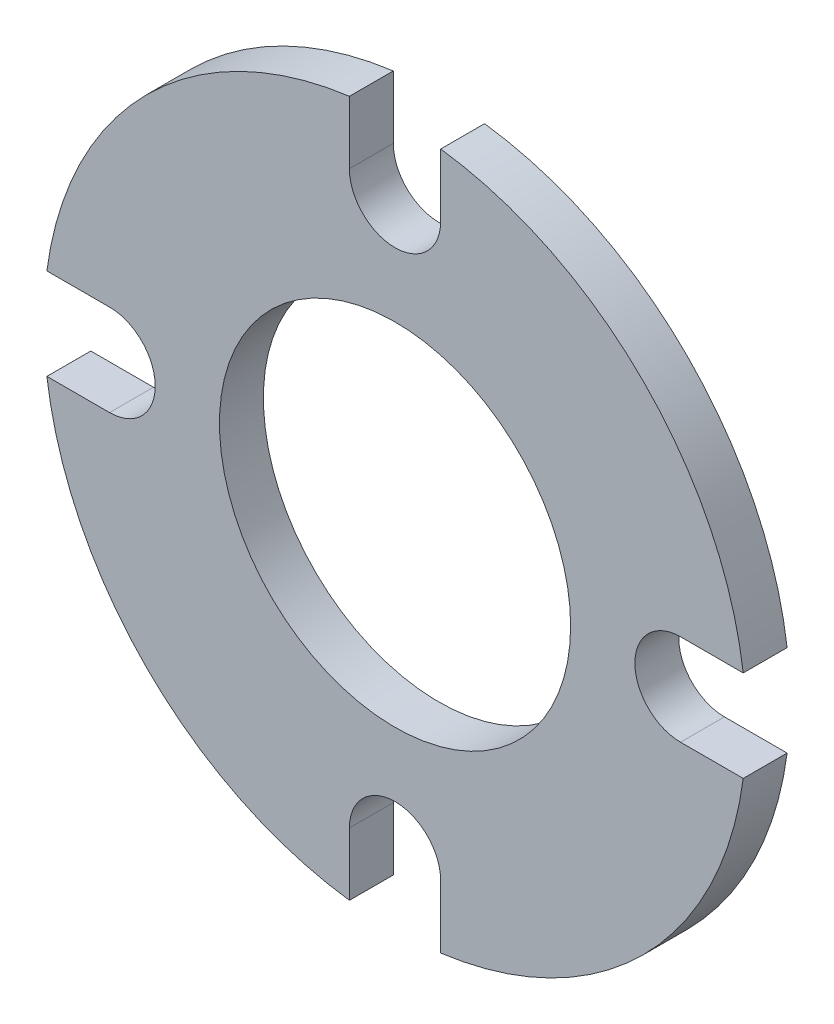
from build123d import *

# Parameters (mm, degrees)
SKETCH2_R           = 0.5
BOSS_EXTRUDE1_DEPTH = 0.125


with BuildPart() as part:
    # Sketch2 → Boss-Extrude1 (new body)
    with BuildSketch(Plane.XY):
        with BuildLine():
            Line((0.813, 0.13), (0.991513994, 0.13))
            ThreePointArc((0.991513994, 0.13), (0.707106781, 0.707106781), (0.13, 0.991513994))
            Line((0.13, 0.991513994), (0.13, 0.813))
            ThreePointArc((0.13, 0.813), (0, 0.683), (-0.13, 0.813))
            Line((-0.13, 0.813), (-0.13, 0.991513994))
            ThreePointArc((-0.13, 0.991513994), (-0.707106781, 0.707106781), (-0.991513994, 0.13))
            Line((-0.991513994, 0.13), (-0.813, 0.13))
            ThreePointArc((-0.813, 0.13), (-0.683, 0), (-0.813, -0.13))
            Line((-0.813, -0.13), (-0.991513994, -0.13))
            ThreePointArc((-0.991513994, -0.13), (-0.707106781, -0.707106781), (-0.13, -0.991513994))
            Line((-0.13, -0.991513994), (-0.13, -0.813))
            ThreePointArc((-0.13, -0.813), (0, -0.683), (0.13, -0.813))
            Line((0.13, -0.813), (0.13, -0.991513994))
            ThreePointArc((0.13, -0.991513994), (0.707106781, -0.707106781), (0.991513994, -0.13))
            Line((0.991513994, -0.13), (0.813, -0.13))
            ThreePointArc((0.813, -0.13), (0.683, 0), (0.813, 0.13))
        make_face()
        Circle(SKETCH2_R, mode=Mode.SUBTRACT)
    extrude(amount=BOSS_EXTRUDE1_DEPTH)


solid = part.part
